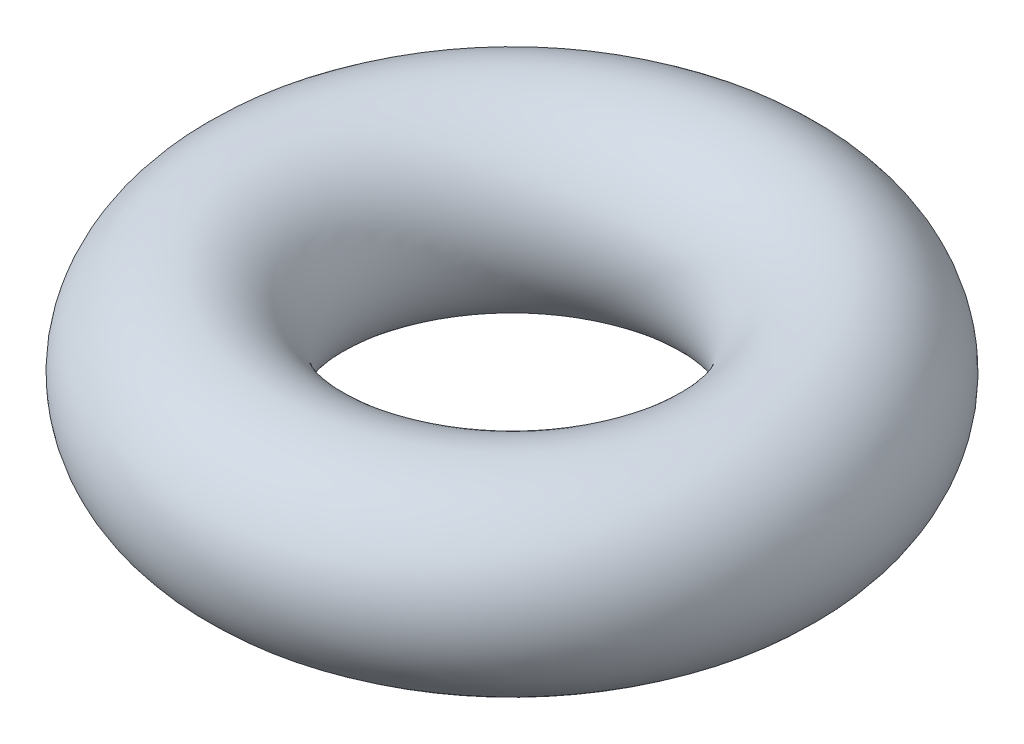
from build123d import *

# Parameters (mm, degrees)
SKETCH1_R = 25.4


with BuildPart() as part:
    # Sketch1 → Revolve1 (revolve)
    with BuildSketch(Plane.XY, mode=Mode.PRIVATE) as revolve1_sk:
        Circle(SKETCH1_R)
    revolve(revolve1_sk.sketch.rotate(Axis((-63.5, 38.38270054, 0), (0, -1, 0)), 180), axis=Axis((-63.5, 38.38270054, 0), (0, -1, 0)))


solid = part.part
